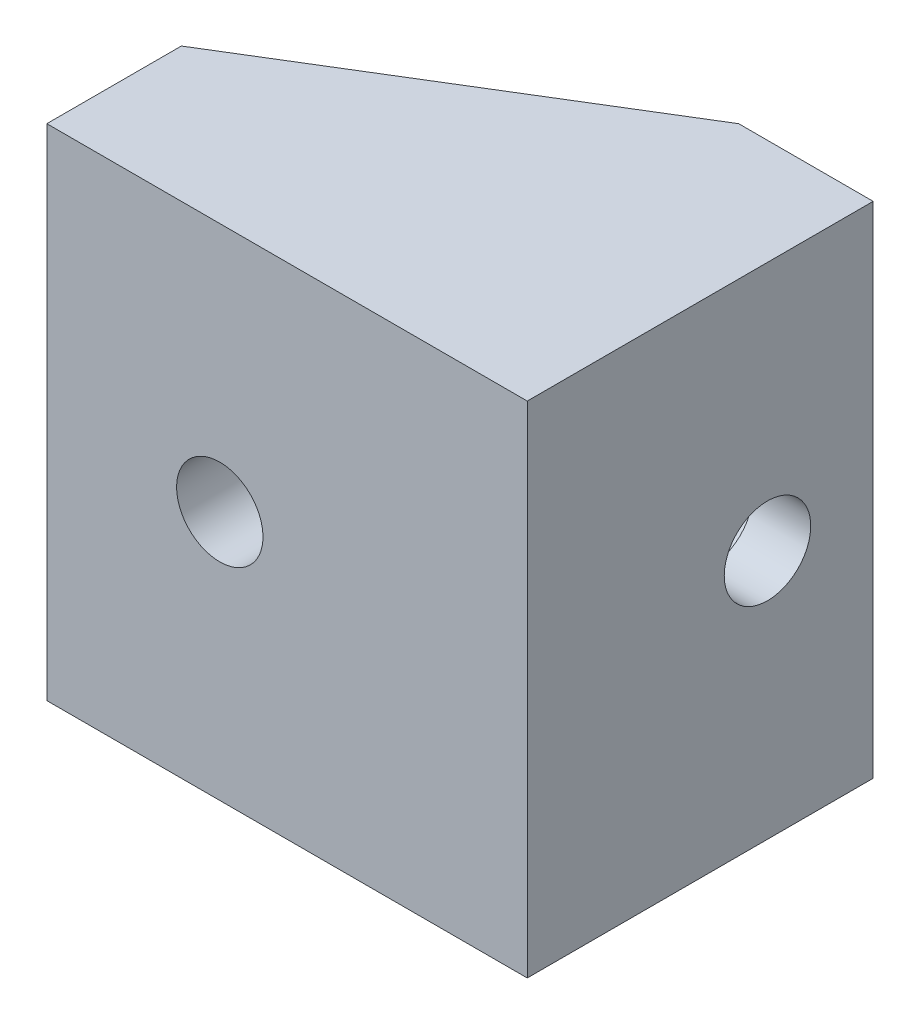
from build123d import *

# Parameters (mm, degrees)
BOSS_EXTRUDE1_DEPTH                               = 20
CBORE_FOR_M4_SHCS1_D                              = 4.5
CBORE_FOR_M4_SHCS1_CBORE_D                        = 8
CBORE_FOR_M4_SHCS1_CBORE_DEPTH                    = 4
CSK_FOR_8_FLAT_HEAD_SOCKET_CAP_SCREW1_D           = 4.4958
CSK_FOR_8_FLAT_HEAD_SOCKET_CAP_SCREW1_CSINK_D     = 10.16
CSK_FOR_8_FLAT_HEAD_SOCKET_CAP_SCREW1_CSINK_ANGLE = 82
BOSS_EXTRUDE2_DEPTH                               = 3
BOSS_EXTRUDE3_START                               = -20
BOSS_EXTRUDE3_DEPTH                               = 3


with BuildPart() as part:
    # Sketch1 → Boss-Extrude1 (new body)
    with BuildSketch(Plane(origin=(0, 0, 0), x_dir=(1, 0, 0), z_dir=(0, 1, 0))):
        Polygon((0, 0), (0, 11), (7, 11), (7, -7), (-18, -7), (-18, 0), align=None)
    extrude(amount=BOSS_EXTRUDE1_DEPTH)

    # CBORE for M4 SHCS1 (through all)
    with Locations(Plane.ZY):
        with Locations((-5.5, 10)):
            CounterBoreHole(CBORE_FOR_M4_SHCS1_D / 2, CBORE_FOR_M4_SHCS1_CBORE_D / 2, CBORE_FOR_M4_SHCS1_CBORE_DEPTH)

    # CSK for #8 Flat Head Socket Cap Screw1 (through all)
    with Locations(Plane(origin=(0, 0, 0), x_dir=(-1, 0, 0), z_dir=(0, 0, -1))):
        with Locations((9, 10)):
            CounterSinkHole(CSK_FOR_8_FLAT_HEAD_SOCKET_CAP_SCREW1_D / 2, CSK_FOR_8_FLAT_HEAD_SOCKET_CAP_SCREW1_CSINK_D / 2, counter_sink_angle=CSK_FOR_8_FLAT_HEAD_SOCKET_CAP_SCREW1_CSINK_ANGLE)

    # Sketch6 → Boss-Extrude2 (add)
    with BuildSketch(Plane.XZ):
        Polygon((-18, 7), (7, 7), (7, -11), (0, -11), (-18, 0), align=None)
    extrude(amount=BOSS_EXTRUDE2_DEPTH)

    # Sketch6<2> → Boss-Extrude3 (add)
    with BuildSketch(Plane.XZ.offset(BOSS_EXTRUDE3_START)):
        Polygon((-18, 7), (7, 7), (7, -11), (0, -11), (-18, 0), align=None)
    extrude(amount=-BOSS_EXTRUDE3_DEPTH)


solid = part.part
